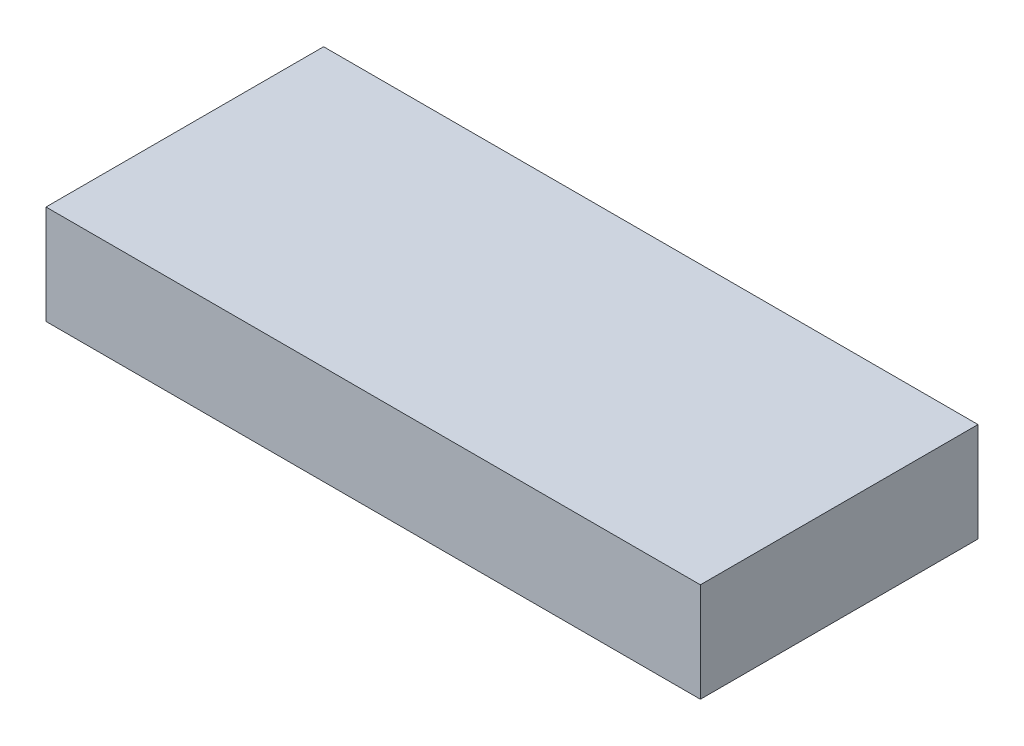
from build123d import *

# Parameters (mm, degrees)
SKETCH1_W           = 28.448
SKETCH1_H           = 7.1882
BOSS_EXTRUDE1_DEPTH = 2.54
SKETCH2_W           = 33.528
SKETCH2_H           = 14.224
BOSS_EXTRUDE2_DEPTH = 5.08


with BuildPart() as part:
    # Sketch1 → Boss-Extrude1 (new body)
    with BuildSketch(Plane(origin=(0, 0, 0), x_dir=(1, 0, 0), z_dir=(0, 1, 0))):
        with Locations((14.224, 3.5941)):
            Rectangle(SKETCH1_W, SKETCH1_H)
    extrude(amount=BOSS_EXTRUDE1_DEPTH)

    # Sketch2 → Boss-Extrude2 (add)
    with BuildSketch(Plane(origin=(0, 2.54, 0), x_dir=(1, 0, 0), z_dir=(0, 1, 0))):
        with Locations((14.224, 3.5941)):
            Rectangle(SKETCH2_W, SKETCH2_H)
    extrude(amount=BOSS_EXTRUDE2_DEPTH)


solid = part.part
